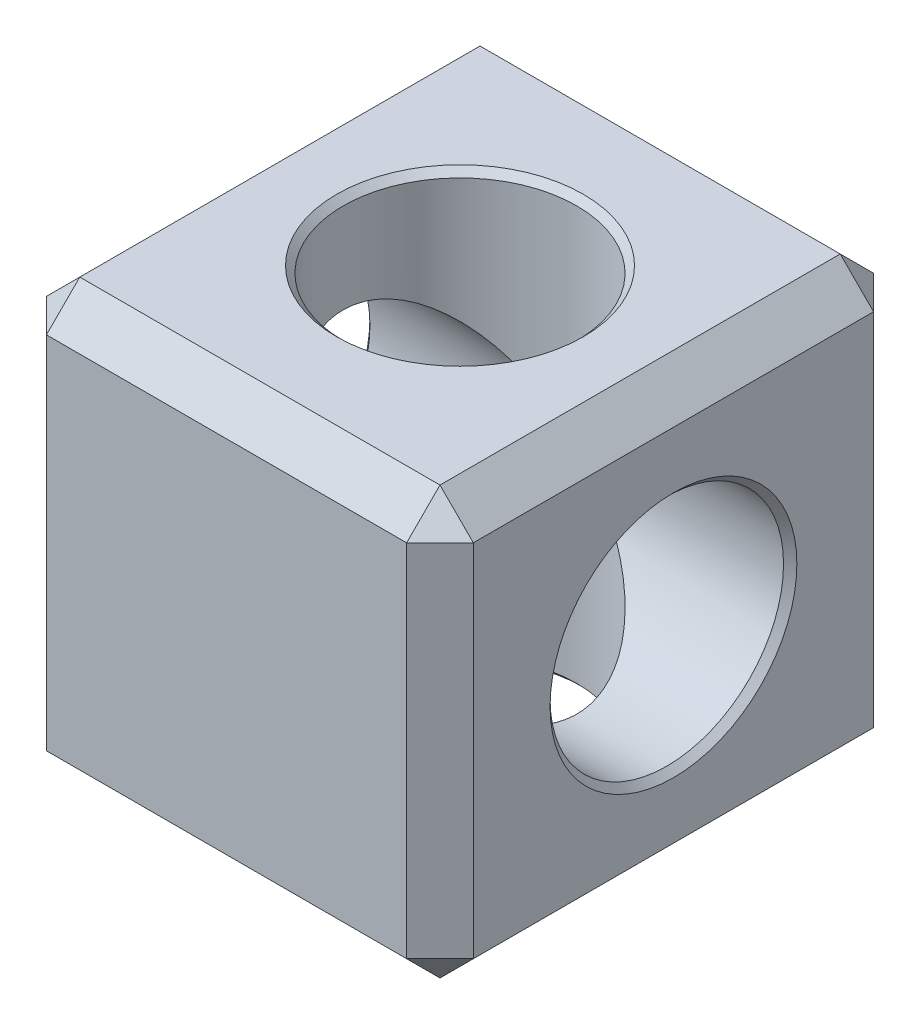
from build123d import *

# Parameters (mm, degrees)
SKETCH1_W           = 64
SKETCH1_H           = 70
BOSS_EXTRUDE1_DEPTH = 32
SKETCH2_R           = 17.5
CUT_EXTRUDE1_DEPTH  = 80.655508284
CIRPATTERN4_COUNT   = 4
CHAMFER1_SIZE       = 5
CHAMFER2_SIZE       = 1


with BuildPart() as part:
    # Sketch1 → Boss-Extrude1 (new, symmetric)
    with BuildSketch(Plane(origin=(0, 0, 0), x_dir=(1, 0, 0), z_dir=(0, 1, 0))):
        Rectangle(SKETCH1_W, SKETCH1_H)
    extrude(amount=BOSS_EXTRUDE1_DEPTH, both=True)

    # Sketch2 → Cut-Extrude1 (cut, through all)
    with BuildSketch(Plane(origin=(0, 32, 0), x_dir=(1, 0, 0), z_dir=(0, 1, 0))):
        Circle(SKETCH2_R)
    cut_extrude1 = extrude(amount=-CUT_EXTRUDE1_DEPTH, mode=Mode.SUBTRACT)

    # CirPattern4: Cut-Extrude1 ×4 about axis
    cirpattern4_axis = Axis((0, 0, 38.5), (0, 0, -1))
    for i in range(1, CIRPATTERN4_COUNT):
        add(cut_extrude1.rotate(cirpattern4_axis, i * 360 / CIRPATTERN4_COUNT), mode=Mode.SUBTRACT)

    # Chamfer1
    chamfer1_edges = [part.edges().sort_by_distance(p)[0] for p in [
        (0, -32, 35),
        (32, 0, 35),
        (-32, 0, 35),
        (-32, -32, 0),
        (-32, 0, -35),
        (0, -32, -35),
        (0, 32, 35),
        (-32, 32, 0),
        (32, -32, 0),
        (32, 0, -35),
        (0, 32, -35),
        (32, 32, 0),
    ]]
    chamfer(chamfer1_edges, length=CHAMFER1_SIZE)

    # Chamfer2
    chamfer2_edges = [part.edges().sort_by_distance(p)[0] for p in [
        (-17.5, -32, 0),
        (32, 17.5, 0),
        (-17.5, 32, 0),
        (-32, 17.5, 0),
    ]]
    chamfer(chamfer2_edges, length=CHAMFER2_SIZE)


solid = part.part
